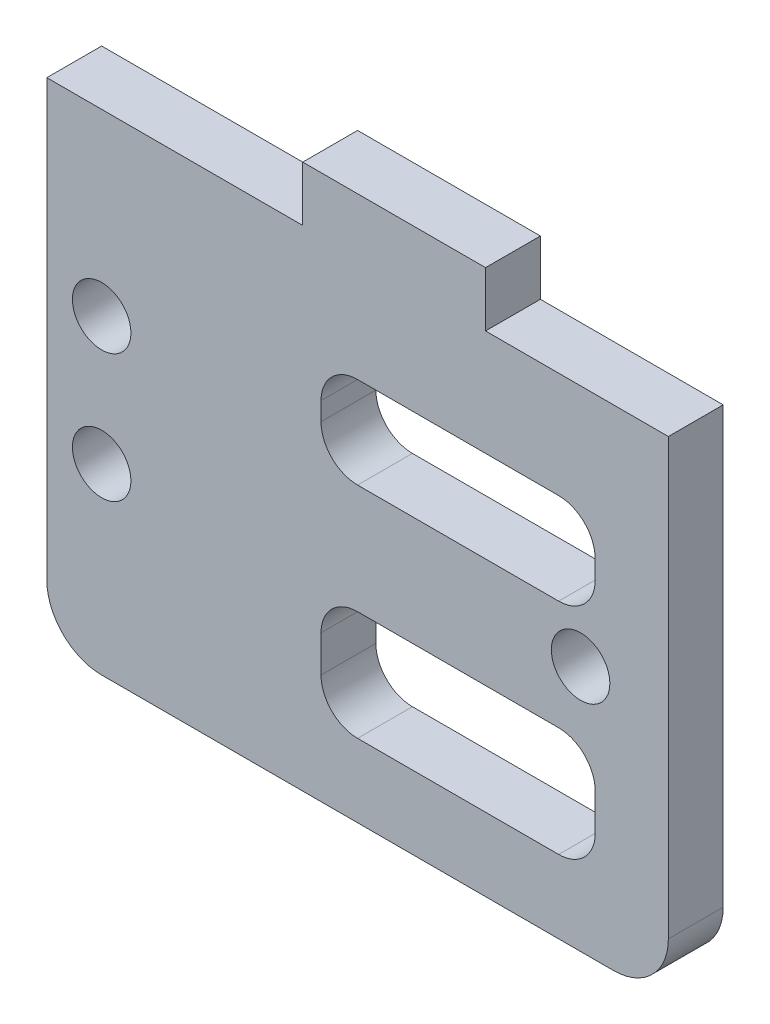
from build123d import *

# Parameters (mm, degrees)
SKETCH_1_R      = 1.6
SKETCH_1_W      = 15
SKETCH_1_H      = 6
SKETCH_1_H_2    = 5
EXTRUDE_1_DEPTH = 3
FILLET_1_R      = 2
FILLET_2_R      = 3


with BuildPart() as part:
    # 草图1 → 凸台-拉伸1 (new body)
    with BuildSketch(Plane.XY):
        Polygon((0, 0), (0, 26.8), (14, 26.8), (14, 29.8), (24, 29.8), (24, 26.8), (34, 26.8), (34, 0), align=None)
        with Locations((3, 17)):
            Circle(SKETCH_1_R, mode=Mode.SUBTRACT)
        with Locations((3, 10)):
            Circle(SKETCH_1_R, mode=Mode.SUBTRACT)
        with Locations((29.2, 13.5)):
            Circle(SKETCH_1_R, mode=Mode.SUBTRACT)
        with Locations((22.5, 7)):
            Rectangle(SKETCH_1_W, SKETCH_1_H, mode=Mode.SUBTRACT)
        with Locations((22.5, 18.5)):
            Rectangle(SKETCH_1_W, SKETCH_1_H_2, mode=Mode.SUBTRACT)
    extrude(amount=EXTRUDE_1_DEPTH)

    # 圆角1
    fillet_1_edges = [part.edges().sort_by_distance(p)[0] for p in [
        (15, 10, 1.5),
        (15, 4, 1.5),
        (30, 4, 1.5),
        (30, 10, 1.5),
        (15, 21, 1.5),
        (15, 16, 1.5),
        (30, 16, 1.5),
        (30, 21, 1.5),
    ]]
    fillet(fillet_1_edges, radius=FILLET_1_R)

    # 圆角2
    fillet_2_edges = [part.edges().sort_by_distance(p)[0] for p in [
        (0, 0, 1.5),
        (34, 0, 1.5),
    ]]
    fillet(fillet_2_edges, radius=FILLET_2_R)


solid = part.part
